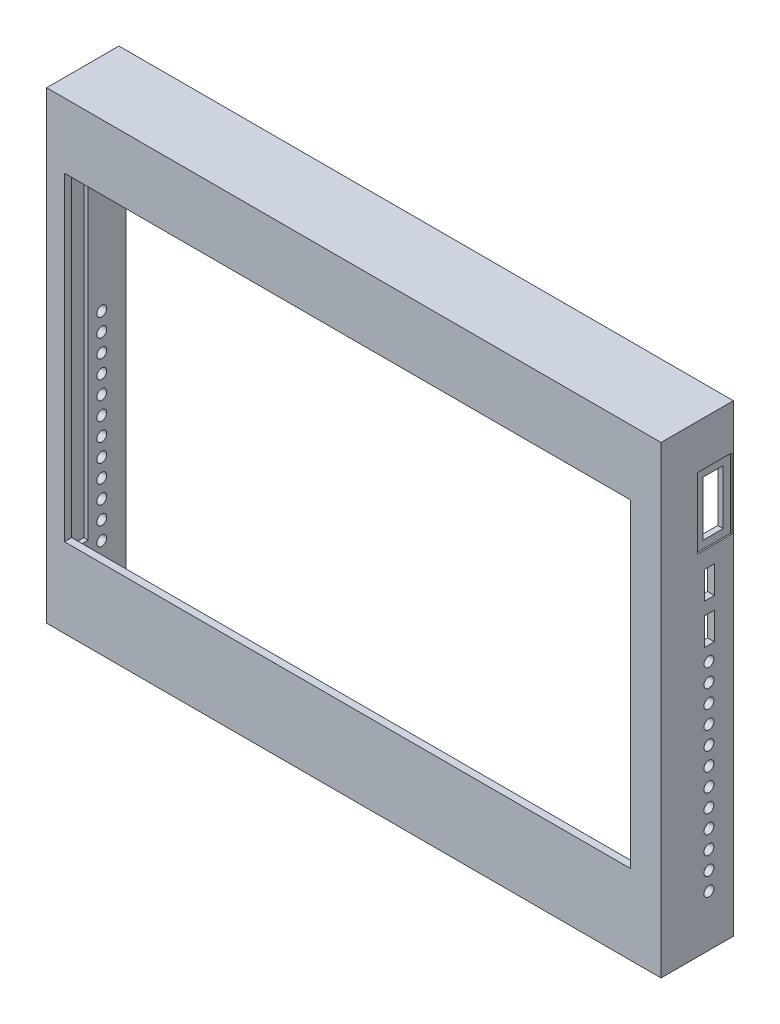
from build123d import *

# Parameters (mm, degrees)
SKETCH_1_W           = 174.66
SKETCH_1_H           = 128.33
EXTRUDE_1_DEPTH      = 20
CUT_EXTRUDE_2_DEPTH  = 8
CUT_EXTRUDE_3_DEPTH  = 10.5
SKETCH_6_W           = 5.6
SKETCH_6_H           = 15.1
SKETCH_6_W_2         = 2.75
SKETCH_6_H_2         = 7.6
CUT_EXTRUDE_4_DEPTH  = 8
SKETCH_7_W           = 9.5
SKETCH_7_H           = 19.5
CUT_EXTRUDE_5_DEPTH  = 2
SKETCH_8_R           = 1.375
CUT_EXTRUDE_6_DEPTH  = 195.468071014
SKETCH_9_W           = 143.3
SKETCH_9_H           = 5.5
SKETCH_9_W_2         = 144.4
SKETCH_9_H_2         = 6.339108063
CUT_EXTRUDE_7_DEPTH  = 18
SKETCH_2_W           = 156.66
SKETCH_2_H           = 88.33
CUT_EXTRUDE_8_DEPTH  = 124.6337279
SKETCH_10_W          = 165
SKETCH_10_H          = 100
CUT_EXTRUDE_10_DEPTH = 7.5
SKETCH_11_W          = 44.991562028
SKETCH_11_H          = 7.165
CUT_EXTRUDE_11_DEPTH = 18
SKETCH_12_W          = 166
SKETCH_12_H          = 124.6
CUT_EXTRUDE_12_DEPTH = 13
SKETCH_13_W          = 150
SKETCH_13_H          = 124.6
CUT_EXTRUDE_15_DEPTH = 5
SKETCH_14_W          = 8
SKETCH_14_H          = 101
CUT_EXTRUDE_16_DEPTH = 5
SKETCH_15_W          = 3.06
SKETCH_15_H          = 128.33
SKETCH_15_W_2        = 1.6
CUT_EXTRUDE_17_DEPTH = 124.6337279
SKETCH_16_W          = 8
SKETCH_16_H          = 11.6
SKETCH_16_H_2        = 10.625891937
EXTRUDE_2_DEPTH      = 3.2


with BuildPart() as part:
    # 草图1 → 凸台-拉伸1 (new body)
    with BuildSketch(Plane.XY):
        with Locations((1.964925, -18.971725)):
            Rectangle(SKETCH_1_W, SKETCH_1_H)
    extrude(amount=EXTRUDE_1_DEPTH)

    # 草图4 → 切除-拉伸2 (cut)
    with BuildSketch(Plane(origin=(0, 0, 0), x_dir=(-1, 0, 0), z_dir=(0, 0, -1))):
        Polygon((-85.794925, 29.193275), (78.715075, 29.193275), (78.715075, -71.136725), (-16.794925, -71.136725), (-16.794925, -74.136725), (-61.794925, -74.136725), (-61.794925, -71.136725), (-85.794925, -71.136725), align=None)
    extrude(amount=-CUT_EXTRUDE_2_DEPTH, mode=Mode.SUBTRACT)

    # 草图5 → 切除-拉伸3 (cut)
    with BuildSketch(Plane(origin=(0, 0, 0), x_dir=(-1, 0, 0), z_dir=(0, 0, -1))):
        Polygon((-76.894925, 34.854166937), (71.505075, 34.854166937), (71.505075, 43.654166937), (80.305075, 43.654166937), (80.305075, 34.854166937), (80.305075, -72.145833063), (80.305075, -80.945833063), (69.505075, -80.945833063), (69.505075, -72.145833063), (-77.794925, -72.145833063), (-77.794925, -80.945833063), (-85.694925, -80.945833063), (-85.694925, -72.145833063), (-85.694925, 34.854166937), (-85.694925, 43.654166937), (-76.894925, 43.654166937), align=None)
    extrude(amount=-CUT_EXTRUDE_3_DEPTH, mode=Mode.SUBTRACT)

    # 草图6 → 切除-拉伸4 (cut)
    with BuildSketch(Plane(origin=(89.294925, 0, 0), x_dir=(0, 0, -1), z_dir=(1, 0, 0))):
        with Locations((-5.2, 23.104166937)):
            Rectangle(SKETCH_6_W, SKETCH_6_H)
        with Locations((-6.625, 4.954166937)):
            Rectangle(SKETCH_6_W_2, SKETCH_6_H_2)
        with Locations((-6.625, -6.145833063)):
            Rectangle(SKETCH_6_W_2, SKETCH_6_H_2)
    extrude(amount=-CUT_EXTRUDE_4_DEPTH, mode=Mode.SUBTRACT)

    # 草图7 → 切除-拉伸5 (cut)
    with BuildSketch(Plane(origin=(89.294925, 0, 0), x_dir=(0, 0, -1), z_dir=(1, 0, 0))):
        with Locations((-5.189589766, 23.17874546)):
            Rectangle(SKETCH_7_W, SKETCH_7_H)
    extrude(amount=-CUT_EXTRUDE_5_DEPTH, mode=Mode.SUBTRACT)

    # 草图8 → 切除-拉伸6 (cut, through all)
    with BuildSketch(Plane(origin=(89.294925, 0, 0), x_dir=(0, 0, -1), z_dir=(1, 0, 0))):
        with Locations(Location((-6.755495721, -13.945833063, 0), (0, 0, 90))):
            Circle(SKETCH_8_R)
        with Locations(Location((-6.755495721, -18.945833063, 0), (0, 0, 90))):
            Circle(SKETCH_8_R)
        with Locations(Location((-6.755495721, -23.945833063, 0), (0, 0, 90))):
            Circle(SKETCH_8_R)
        with Locations(Location((-6.755495721, -28.945833063, 0), (0, 0, 90))):
            Circle(SKETCH_8_R)
        with Locations(Location((-6.755495721, -33.945833063, 0), (0, 0, 90))):
            Circle(SKETCH_8_R)
        with Locations(Location((-6.755495721, -38.945833063, 0), (0, 0, 90))):
            Circle(SKETCH_8_R)
        with Locations(Location((-6.755495721, -43.945833063, 0), (0, 0, 90))):
            Circle(SKETCH_8_R)
        with Locations(Location((-6.755495721, -48.945833063, 0), (0, 0, 90))):
            Circle(SKETCH_8_R)
        with Locations(Location((-6.755495721, -53.945833063, 0), (0, 0, 90))):
            Circle(SKETCH_8_R)
        with Locations(Location((-6.755495721, -58.945833063, 0), (0, 0, 90))):
            Circle(SKETCH_8_R)
        with Locations(Location((-6.755495721, -63.945833063, 0), (0, 0, 90))):
            Circle(SKETCH_8_R)
        with Locations(Location((-6.755495721, -68.945833063, 0), (0, 0, 90))):
            Circle(SKETCH_8_R)
    extrude(amount=-CUT_EXTRUDE_6_DEPTH, mode=Mode.SUBTRACT)

    # 草图9 → 切除-拉伸7 (cut)
    with BuildSketch(Plane(origin=(0, 0, 0), x_dir=(-1, 0, 0), z_dir=(0, 0, -1))):
        with Locations((-4.144925, -78.386725)):
            Rectangle(SKETCH_9_W, SKETCH_9_H)
        with Locations((-2.694925, 40.023720969)):
            Rectangle(SKETCH_9_W_2, SKETCH_9_H_2)
    extrude(amount=-CUT_EXTRUDE_7_DEPTH, mode=Mode.SUBTRACT)

    # 草图2 → 切除-拉伸8 (cut, through all)
    with BuildSketch(Plane.XY.offset(20)):
        with Locations((0.964925, -16.971725)):
            Rectangle(SKETCH_2_W, SKETCH_2_H)
    extrude(amount=-CUT_EXTRUDE_8_DEPTH, mode=Mode.SUBTRACT)

    # 草图10 → 切除-拉伸10 (cut)
    with BuildSketch(Plane(origin=(0, 0, 10.5), x_dir=(-1, 0, 0), z_dir=(0, 0, -1))):
        with Locations((-0.964925, -16.971725)):
            Rectangle(SKETCH_10_W, SKETCH_10_H)
    extrude(amount=-CUT_EXTRUDE_10_DEPTH, mode=Mode.SUBTRACT)

    # 草图11 → 切除-拉伸11 (cut)
    with BuildSketch(Plane(origin=(0, 0, 0), x_dir=(-1, 0, 0), z_dir=(0, 0, -1))):
        with Locations((-39.290706014, -70.554225)):
            Rectangle(SKETCH_11_W, SKETCH_11_H)
    extrude(amount=-CUT_EXTRUDE_11_DEPTH, mode=Mode.SUBTRACT)

    # 草图12 → 切除-拉伸12 (cut)
    with BuildSketch(Plane(origin=(0, 0, 0), x_dir=(-1, 0, 0), z_dir=(0, 0, -1))):
        with Locations((-2.694925, -18.645833063)):
            Rectangle(SKETCH_12_W, SKETCH_12_H)
    extrude(amount=-CUT_EXTRUDE_12_DEPTH, mode=Mode.SUBTRACT)

    # 草图13 → 切除-拉伸15 (cut)
    with BuildSketch(Plane(origin=(0, 0, 13), x_dir=(-1, 0, 0), z_dir=(0, 0, -1))):
        with Locations((-2.694925, -18.645833063)):
            Rectangle(SKETCH_13_W, SKETCH_13_H)
    extrude(amount=-CUT_EXTRUDE_15_DEPTH, mode=Mode.SUBTRACT)

    # 草图14 → 切除-拉伸16 (cut)
    with BuildSketch(Plane(origin=(0, 0, 13), x_dir=(-1, 0, 0), z_dir=(0, 0, -1))):
        with Locations((76.305075, -18.845833063)):
            Rectangle(SKETCH_14_W, SKETCH_14_H)
        with Locations((-81.694925, -18.845833063)):
            Rectangle(SKETCH_14_W, SKETCH_14_H)
    extrude(amount=-CUT_EXTRUDE_16_DEPTH, mode=Mode.SUBTRACT)

    # 草图15 → 切除-拉伸17 (cut, through all)
    with BuildSketch(Plane(origin=(0, 0, 0), x_dir=(-1, 0, 0), z_dir=(0, 0, -1))):
        with Locations((83.835075, -18.971725)):
            Rectangle(SKETCH_15_W, SKETCH_15_H)
        with Locations((-88.494925, -18.971725)):
            Rectangle(SKETCH_15_W_2, SKETCH_15_H)
    extrude(amount=-CUT_EXTRUDE_17_DEPTH, mode=Mode.SUBTRACT)

    # 草图16 → 凸台-拉伸2 (add)
    with BuildSketch(Plane(origin=(0, 0, 13), x_dir=(-1, 0, 0), z_dir=(0, 0, -1))):
        with Locations((76.305075, -75.145833063)):
            Rectangle(SKETCH_16_W, SKETCH_16_H)
        with Locations((-81.694925, -75.145833063)):
            Rectangle(SKETCH_16_W, SKETCH_16_H)
        with Locations((76.305075, 38.341220968)):
            Rectangle(SKETCH_16_W, SKETCH_16_H_2)
        with Locations((-81.694925, 38.341220968)):
            Rectangle(SKETCH_16_W, SKETCH_16_H_2)
    extrude(amount=EXTRUDE_2_DEPTH)


solid = part.part
